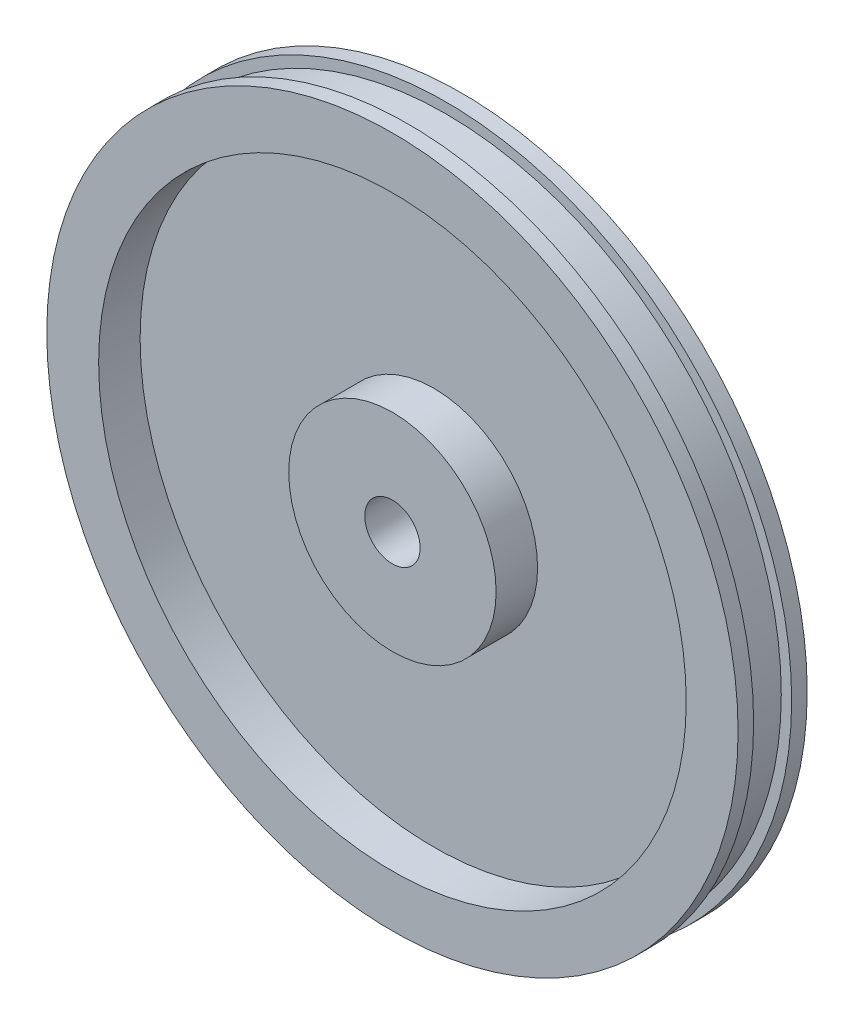
from build123d import *

# Parameters (mm, degrees)
SKETCH_1_R          = 100
EXTRUDE_1_DEPTH     = 20
SKETCH_2_R          = 8
CUT_EXTRUDE_1_DEPTH = 20
SKETCH_3_R          = 85
SKETCH_3_R_2        = 30
CUT_EXTRUDE_2_DEPTH = 12
SKETCH_5_W          = 3
SKETCH_5_H          = 11
SKETCH_8_R          = 30
EXTRUDE_2_DEPTH     = 6
CUT_EXTRUDE_START   = -52
SKETCH_9_R          = 8
CUT_EXTRUDE_4_DEPTH = 52


with BuildPart() as part:
    # 草图1 → 凸台-拉伸1 (new body)
    with BuildSketch(Plane.XY):
        Circle(SKETCH_1_R)
    extrude(amount=EXTRUDE_1_DEPTH)

    # 草图2 → 切除-拉伸1 (cut)
    with BuildSketch(Plane.XY.offset(20)):
        Circle(SKETCH_2_R)
    extrude(amount=-CUT_EXTRUDE_1_DEPTH, mode=Mode.SUBTRACT)

    # 草图3 → 切除-拉伸2 (cut)
    with BuildSketch(Plane.XY.offset(20)):
        Circle(SKETCH_3_R)
        Circle(SKETCH_3_R_2, mode=Mode.SUBTRACT)
    extrude(amount=-CUT_EXTRUDE_2_DEPTH, mode=Mode.SUBTRACT)

    # 草图5 → 切除-旋转2 (revolve, cut)
    with BuildSketch(Plane(origin=(0, 0, 0), x_dir=(1, 0, 0), z_dir=(0, 1, 0)), mode=Mode.PRIVATE) as cut_revolve_2_sk:
        with Locations((98.5, -10)):
            Rectangle(SKETCH_5_W, SKETCH_5_H)
    revolve(cut_revolve_2_sk.sketch.rotate(Axis((0, 0, -40.303548102), (0, 0, 1)), 180), axis=Axis((0, 0, -40.303548102), (0, 0, 1)), mode=Mode.SUBTRACT)

    # 草图8 → 凸台-拉伸2 (add)
    with BuildSketch(Plane(origin=(0, 0, 0), x_dir=(-1, 0, 0), z_dir=(0, 0, -1))):
        with Locations(Location((0, 0, 0), (0, 0, 180))):
            Circle(SKETCH_8_R)
    extrude(amount=EXTRUDE_2_DEPTH)

    # 草图9 → 切除-拉伸4 (cut)
    with BuildSketch(Plane(origin=(0, 0, -6), x_dir=(-1, 0, 0), z_dir=(0, 0, -1)).offset(CUT_EXTRUDE_START)):
        with Locations(Location((0, 0, 0), (0, 0, 180))):
            Circle(SKETCH_9_R)
    extrude(amount=CUT_EXTRUDE_4_DEPTH, mode=Mode.SUBTRACT)


solid = part.part
